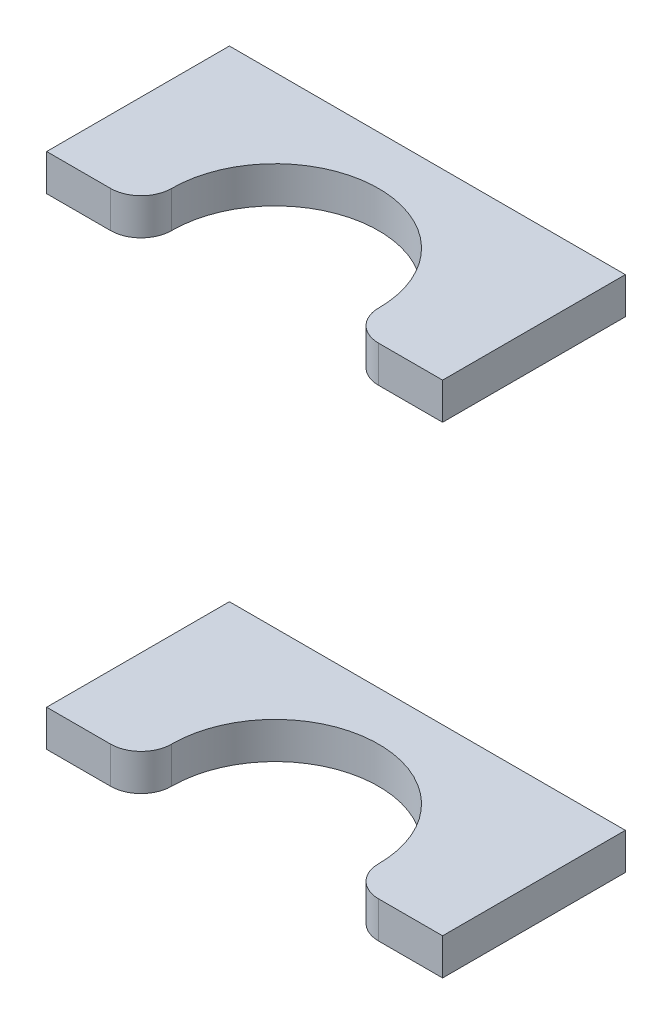
from build123d import *

# Parameters (mm, degrees)
SKETCH1_W             = 65
SKETCH1_H             = 6
BOSS_EXTRUDE1_DEPTH   = 44
BOSS_EXTRUDE1_2_DEPTH = 44
CUT_EXTRUDE4_DEPTH    = 396.74865761


with BuildPart() as part:
    # Sketch1 → Boss-Extrude1 (new body)
    with BuildSketch(Plane.XY):
        with Locations((-351.5, 23)):
            Rectangle(SKETCH1_W, SKETCH1_H)
    extrude(amount=BOSS_EXTRUDE1_DEPTH)


with BuildPart() as body_2:
    # Sketch1 → Boss-Extrude1 2 (new body)
    with BuildSketch(Plane.XY):
        with Locations((-351.5, 102)):
            Rectangle(SKETCH1_W, SKETCH1_H)
    extrude(amount=BOSS_EXTRUDE1_2_DEPTH)


with BuildPart() as cut_extrude4_tool:
    # Sketch4 → Cut-Extrude4 (new, through all)
    with BuildSketch(Plane(origin=(0, 20, 0), x_dir=(-1, 0, 0), z_dir=(0, -1, 0))):
        with BuildLine():
            Line((319, -30), (319, -44))
            Line((319, -44), (384, -44))
            Line((384, -44), (384, -30))
            Line((384, -30), (373.5, -30))
            ThreePointArc((373.5, -30), (369.964466094, -28.535533906), (368.5, -25))
            ThreePointArc((368.5, -25), (351.5, -8), (334.5, -25))
            ThreePointArc((334.5, -25), (333.035533906, -28.535533906), (329.5, -30))
            Line((329.5, -30), (319, -30))
        make_face()
    extrude(amount=-CUT_EXTRUDE4_DEPTH)


with BuildPart() as part_1:
    add(part.part)

    # Cut-Extrude4: cut by cut_extrude4_tool
    add(cut_extrude4_tool.part, mode=Mode.SUBTRACT)


with BuildPart() as body_2_1:
    add(body_2.part)

    # Cut-Extrude4: cut by cut_extrude4_tool
    add(cut_extrude4_tool.part, mode=Mode.SUBTRACT)


solid = Compound([part_1.part, body_2_1.part])
